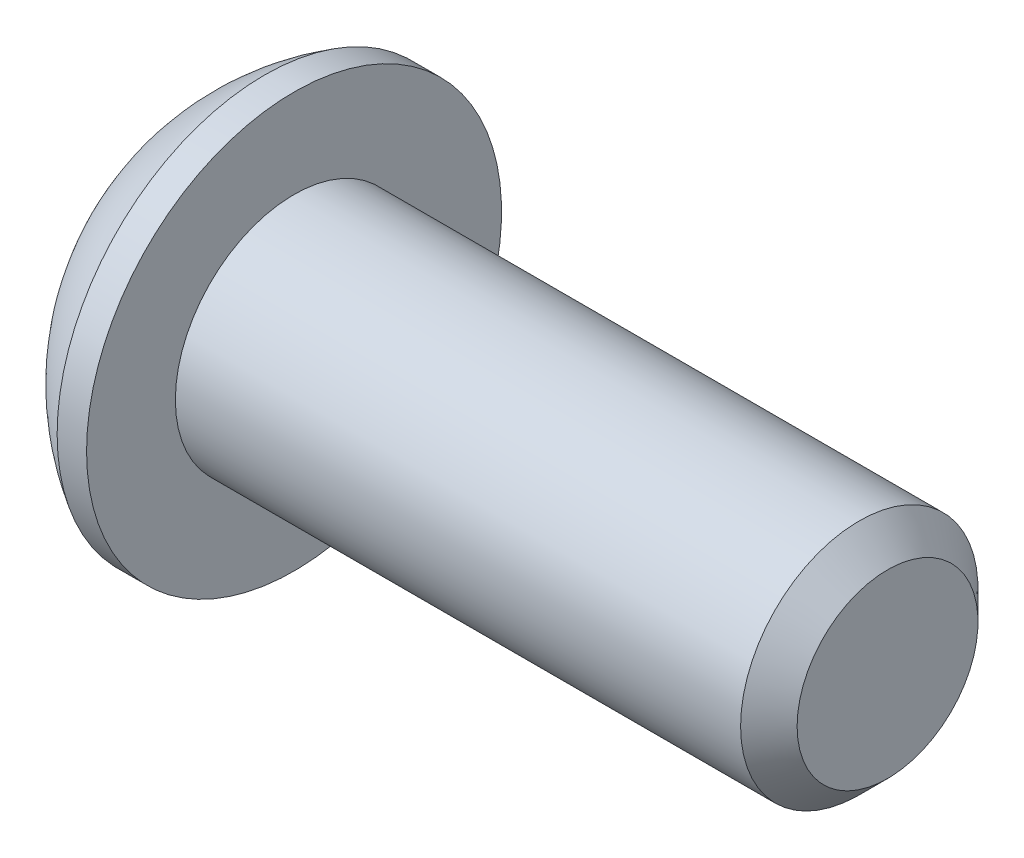
from build123d import *

# Parameters (mm, degrees)
HEX_2_DEPTH = 2.2098


with BuildPart() as part:
    # BodySke → BaseBody (revolve)
    with BuildSketch(Plane.XY, mode=Mode.PRIVATE) as basebody_sk:
        with BuildLine():
            Line((19.2278, 0), (19.2278, 2.41935))
            Line((19.2278, 2.41935), (18.47215, 3.175))
            Line((18.47215, 3.175), (3.3528, 3.175))
            Line((3.3528, 3.175), (3.3528, 5.5499))
            Line((3.3528, 5.5499), (2.5654, 5.5499))
            ThreePointArc((2.5654, 5.5499), (1.073764503, 4.355582759), (0, 2.77495))
            Line((0, 2.77495), (0, 0))
            Line((0, 0), (19.2278, 0))
        make_face()
    revolve(basebody_sk.sketch.rotate(Axis((0, 0, 0), (1, 0, 0)), 90), axis=Axis((0, 0, 0), (1, 0, 0)))

    # Sketch2 → PreBroach (revolve, cut)
    with BuildSketch(Plane.XY, mode=Mode.PRIVATE) as prebroach_sk:
        Polygon((0, 1.9812), (2.2098, 1.9812), (3.353646353, 0), (0, 0), align=None)
    revolve(prebroach_sk.sketch.rotate(Axis((0, 0, 0), (1, 0, 0)), 90), axis=Axis((0, 0, 0), (1, 0, 0)), mode=Mode.SUBTRACT)

    # Sketch3 → Hex 2 (cut)
    with BuildSketch(Plane(origin=(0, 0, 0), x_dir=(0, 0, -1), z_dir=(1, 0, 0))):
        Polygon((-1.9812, -1.143846353), (-1.9812, 1.143846353), (0, 2.287692707), (1.9812, 1.143846353), (1.9812, -1.143846353), (0, -2.287692707), align=None)
    extrude(amount=HEX_2_DEPTH, mode=Mode.SUBTRACT)


solid = part.part
